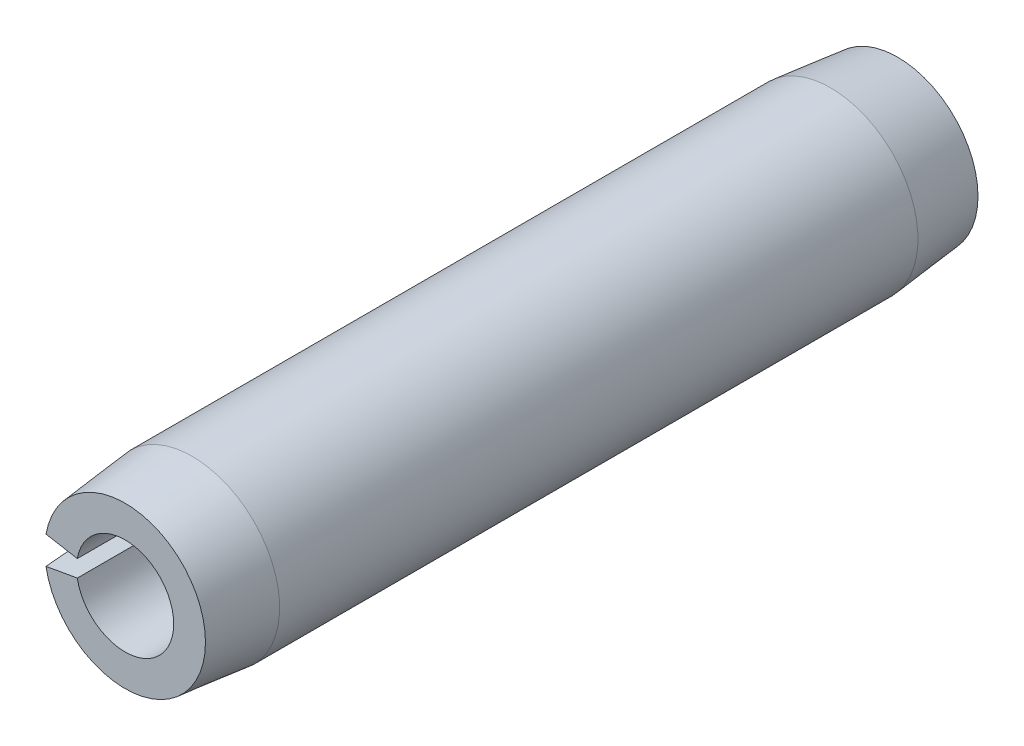
from build123d import *

# Parameters (mm, degrees)
EXTRUDE1_DEPTH = 5.55625


with BuildPart() as part:
    # Sketch1 → Extrude1 (new, symmetric)
    with BuildSketch(Plane.XY):
        with BuildLine():
            Line((-1.238198788, 0.218327854), (-0.687888215, 0.121293252))
            ThreePointArc((-0.687888215, 0.121293252), (0.6985, 0), (-0.687888215, -0.121293252))
            Line((-0.687888215, -0.121293252), (-1.238198788, -0.218327854))
            ThreePointArc((-1.238198788, -0.218327854), (1.2573, 0), (-1.238198788, 0.218327854))
        make_face()
    extrude(amount=EXTRUDE1_DEPTH, both=True)

    # Sketch2 → Cut-Revolve1 (revolve, cut)
    with BuildSketch(Plane(origin=(0, 0, 0), x_dir=(0, 0, -1), z_dir=(1, 0, 0))):
        Polygon((5.55625, 1.2573), (5.55625, 1.1557), (4.59105, 1.2573), align=None)
        Polygon((-4.59105, 1.2573), (-5.55625, 1.2573), (-5.55625, 1.1557), align=None)
    revolve(axis=Axis((0, 0, -5.55625), (0, 0, 1)), mode=Mode.SUBTRACT)


solid = part.part
